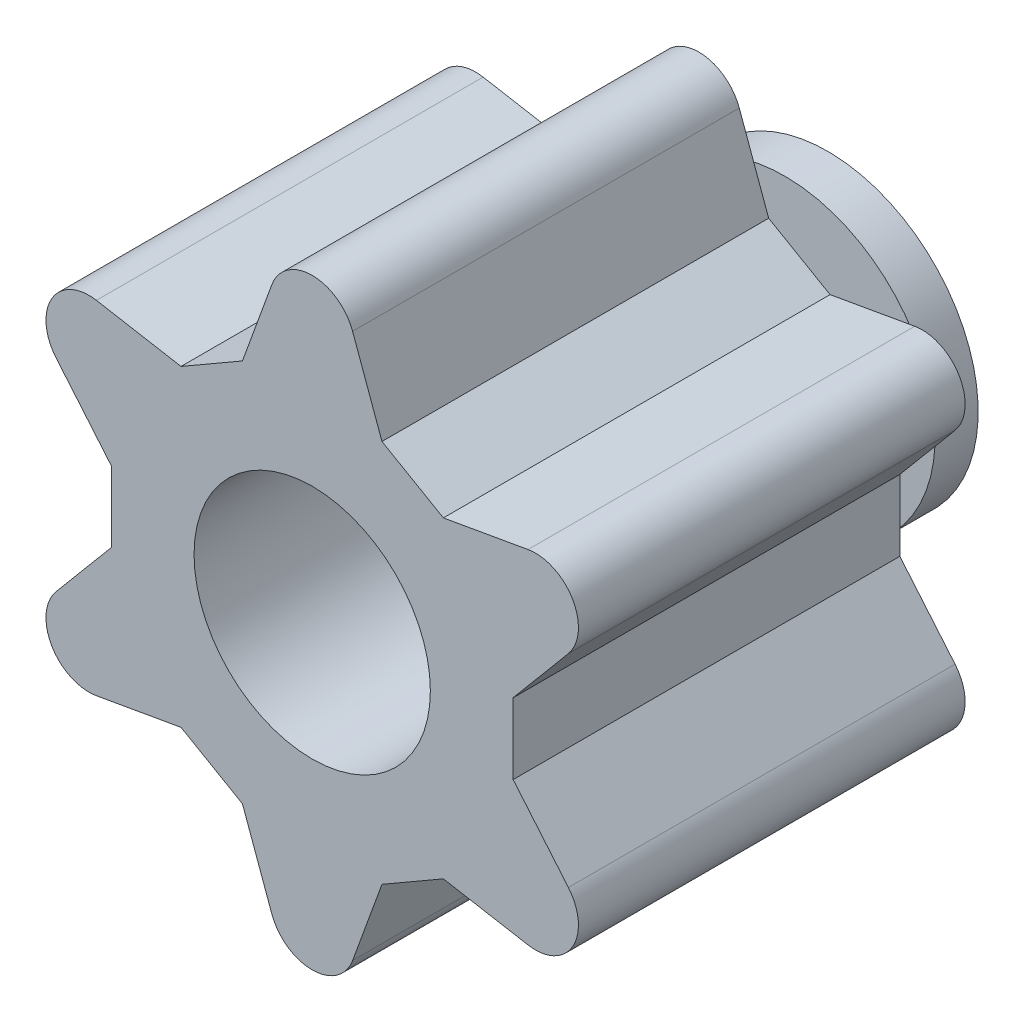
from build123d import *

# Parameters (mm, degrees)
BOSS_EXTRUDE1_DEPTH = 9
SKETCH5_R           = 1.4
BOSS_EXTRUDE2_DEPTH = 6.5
SKETCH6_R           = 2.75
CUT_EXTRUDE1_DEPTH  = 5
SKETCH9_R           = 3.5
SKETCH9_R_2         = 1.5
BOSS_EXTRUDE3_DEPTH = 1


with BuildPart() as part:
    # Sketch1 → Boss-Extrude1 (new body)
    with BuildSketch(Plane.XY):
        with BuildLine():
            Line((-1.623732907, 4.462634902), (-0.939692621, 6.342020143))
            ThreePointArc((-0.939692621, 6.342020143), (0, 7), (0.939692621, 6.342020143))
            Line((0.939692621, 6.342020143), (1.623732907, 4.462634902))
            Line((1.623732907, 4.462634902), (3.052888739, 3.637511398))
            Line((3.052888739, 3.637511398), (5.022504245, 3.984807753))
            ThreePointArc((5.022504245, 3.984807753), (6.062177826, 3.5), (5.962196866, 2.35721239))
            Line((5.962196866, 2.35721239), (4.676621646, 0.825123504))
            Line((4.676621646, 0.825123504), (4.676621646, -0.825123504))
            Line((4.676621646, -0.825123504), (5.962196866, -2.35721239))
            ThreePointArc((5.962196866, -2.35721239), (6.062177826, -3.5), (5.022504245, -3.984807753))
            Line((5.022504245, -3.984807753), (3.052888739, -3.637511398))
            Line((3.052888739, -3.637511398), (1.623732907, -4.462634902))
            Line((1.623732907, -4.462634902), (0.939692621, -6.342020143))
            ThreePointArc((0.939692621, -6.342020143), (0, -7), (-0.939692621, -6.342020143))
            Line((-0.939692621, -6.342020143), (-1.623732907, -4.462634902))
            Line((-1.623732907, -4.462634902), (-3.052888739, -3.637511398))
            Line((-3.052888739, -3.637511398), (-5.022504245, -3.984807753))
            ThreePointArc((-5.022504245, -3.984807753), (-6.062177826, -3.5), (-5.962196866, -2.35721239))
            Line((-5.962196866, -2.35721239), (-4.676621646, -0.825123504))
            Line((-4.676621646, -0.825123504), (-4.676621646, 0.825123504))
            Line((-4.676621646, 0.825123504), (-5.962196866, 2.35721239))
            ThreePointArc((-5.962196866, 2.35721239), (-6.062177826, 3.5), (-5.022504245, 3.984807753))
            Line((-5.022504245, 3.984807753), (-3.052888739, 3.637511398))
            Line((-3.052888739, 3.637511398), (-1.623732907, 4.462634902))
        make_face()
        Polygon((2.75, -1.58771324), (2.75, 1.58771324), (0, 3.175426481), (-2.75, 1.58771324), (-2.75, -1.58771324), (0, -3.175426481), align=None, mode=Mode.SUBTRACT)
    extrude(amount=BOSS_EXTRUDE1_DEPTH)

    # Sketch5 → Boss-Extrude2 (add)
    with BuildSketch(Plane(origin=(0, 0, 2.5), x_dir=(-1, 0, 0), z_dir=(0, 0, -1))):
        Polygon((-2.75, 1.58771324), (0, 3.175426481), (2.75, 1.58771324), (2.75, -1.58771324), (0, -3.175426481), (-2.75, -1.58771324), align=None)
        Circle(SKETCH5_R, mode=Mode.SUBTRACT)
    extrude(amount=-BOSS_EXTRUDE2_DEPTH)

    # Sketch6 → Cut-Extrude1 (cut)
    with BuildSketch(Plane.XY.offset(9)):
        Circle(SKETCH6_R)
    extrude(amount=-CUT_EXTRUDE1_DEPTH, mode=Mode.SUBTRACT)


with BuildPart() as body_2:
    # Sketch9 → Boss-Extrude3 (new body)
    with BuildSketch(Plane(origin=(0, 0, -2), x_dir=(-1, 0, 0), z_dir=(0, 0, -1))):
        Circle(SKETCH9_R)
        Circle(SKETCH9_R_2, mode=Mode.SUBTRACT)
    extrude(amount=BOSS_EXTRUDE3_DEPTH)


solid = Compound([part.part, body_2.part])
